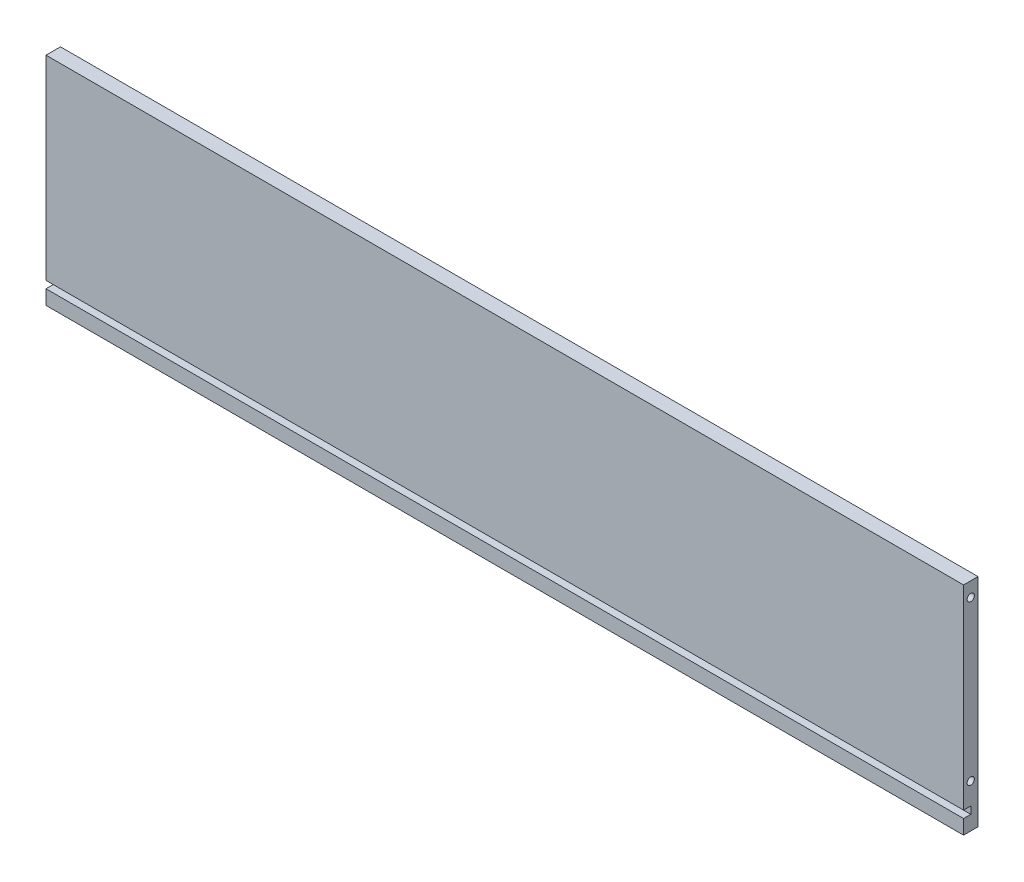
from build123d import *

# Parameters (mm, degrees)
SKETCH1_W                               = 635
SKETCH1_H                               = 150
BASE_EXTRUDE_DEPTH                      = 10
SKETCH2_W                               = 5
SKETCH2_H                               = 5
CUT_EXTRUDE1_DEPTH                      = 641.097648801
M5_0_5_000000_DIAMETER_HOLE1_AT_2_COUNT = 2
M5_0_5_000000_DIAMETER_HOLE1_AT_2_PITCH = 110


with BuildPart() as part:
    # Sketch1 → Base-Extrude (new body)
    with BuildSketch(Plane.XY):
        with Locations((0, 5)):
            Rectangle(SKETCH1_W, SKETCH1_H)
    extrude(amount=BASE_EXTRUDE_DEPTH)

    # Sketch2 → Cut-Extrude1 (cut, through all)
    with BuildSketch(Plane(origin=(317.5, 0, 0), x_dir=(0, 0, -1), z_dir=(1, 0, 0))):
        with Locations((-7.5, -57.5)):
            Rectangle(SKETCH2_W, SKETCH2_H)
    extrude(amount=-CUT_EXTRUDE1_DEPTH, mode=Mode.SUBTRACT)

    # Sketch4 → M5.0 (5.000000) Diameter Hole1 (revolve, cut)
    with BuildSketch(Plane(origin=(317.5, 70, 5), x_dir=(0, 0, -1), z_dir=(0, 1, 0))):
        Polygon((0, 0), (0, 16.502151548), (2.5, 15), (2.5, 0), align=None)
    m5_0_5_000000_diameter_hole1 = revolve(axis=Axis((323.85, 70, 5), (-1, 0, 0)), mode=Mode.SUBTRACT)

    # M5.0 (5.000000) Diameter Hole1 at 2: M5.0 (5.000000) Diameter Hole1 ×2
    with Locations(*[(0, -i * M5_0_5_000000_DIAMETER_HOLE1_AT_2_PITCH, 0) for i in range(1, M5_0_5_000000_DIAMETER_HOLE1_AT_2_COUNT)]):
        add(m5_0_5_000000_diameter_hole1, mode=Mode.SUBTRACT)

    # Mirror1: M5.0 (5.000000) Diameter Hole1 across plane
    add(m5_0_5_000000_diameter_hole1.mirror(Plane(origin=(0, 0, 0), x_dir=(0, 0, 1), z_dir=(1, 0, 0))), mode=Mode.SUBTRACT)

    # Mirror1 copy 1 sketch → Mirror1 copy 1 (revolve, cut)
    with BuildSketch(Plane(origin=(-317.5, -40, 5), x_dir=(0, 0, -1), z_dir=(0, 1, 0))):
        Polygon((0, 0), (0, -16.502151548), (2.5, -15), (2.5, 0), align=None)
    revolve(axis=Axis((-323.85, -40, 5), (-1, 0, 0)), mode=Mode.SUBTRACT)


solid = part.part
